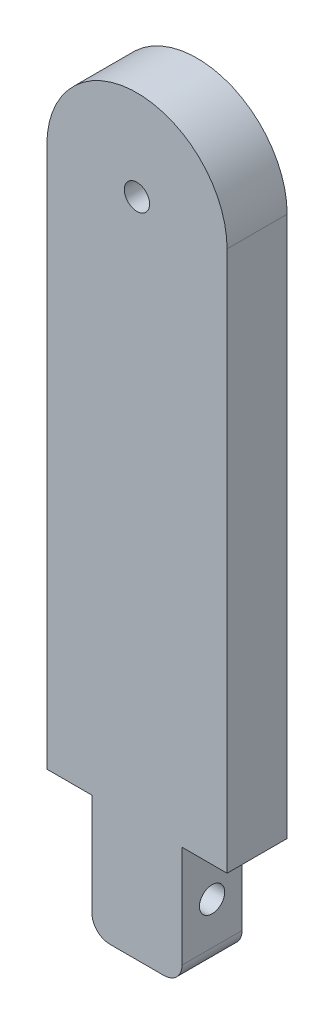
from build123d import *

# Parameters (mm, degrees)
SKETCH_1_W          = 30
SKETCH_1_H          = 125
EXTRUDE_1_DEPTH     = 10
SKETCH_2_W          = 7.5
SKETCH_2_H          = 20
CUT_EXTRUDE_1_DEPTH = 10
FILLET_1_R          = 3
SKETCH_3_R          = 2.1
CUT_EXTRUDE_2_DEPTH = 129.937969582
FILLET_2_RADIUS     = 15
FILLET_2_LENGTH     = 10
SKETCH_4_R          = 2.1
CUT_EXTRUDE_3_DEPTH = 129.937969582


with BuildPart() as part:
    # 草图1 → 凸台-拉伸1 (new body)
    with BuildSketch(Plane.XY):
        with Locations((15, 62.5)):
            Rectangle(SKETCH_1_W, SKETCH_1_H)
    extrude(amount=EXTRUDE_1_DEPTH)

    # 草图2 → 切除-拉伸1 (cut)
    with BuildSketch(Plane.XY.offset(10)):
        with Locations((3.75, 10)):
            Rectangle(SKETCH_2_W, SKETCH_2_H)
        with Locations((26.25, 10)):
            Rectangle(SKETCH_2_W, SKETCH_2_H)
    extrude(amount=-CUT_EXTRUDE_1_DEPTH, mode=Mode.SUBTRACT)

    # 圆角1
    fillet_1_edges = [part.edges().sort_by_distance(p)[0] for p in [
        (7.5, 0, 5),
        (22.5, 0, 5),
    ]]
    fillet(fillet_1_edges, radius=FILLET_1_R)

    # 草图3 → 切除-拉伸2 (cut, through all)
    with BuildSketch(Plane.ZY):
        with Locations((5, 10)):
            Circle(SKETCH_3_R)
    extrude(amount=-CUT_EXTRUDE_2_DEPTH, mode=Mode.SUBTRACT)

    # 圆角2: full round fillet: the end face becomes a half cylinder, R = half its width
    fillet_2_face = Plane((15, 125, 5), x_dir=(0, 0, 1), z_dir=(0, 1, 0))  # on the end face: x along it, z out of the body
    fillet_2_slab = fillet_2_face.offset(-FILLET_2_RADIUS / 2) * Box(FILLET_2_LENGTH, 2 * FILLET_2_RADIUS, FILLET_2_RADIUS, mode=Mode.PRIVATE)  # the body's end, R deep
    fillet_2_round = Plane((15, 110, 5), x_dir=(0, 1, 0), z_dir=(0, 0, 1)) * Cylinder(FILLET_2_RADIUS, FILLET_2_LENGTH, mode=Mode.PRIVATE)  # its axis R under the face
    add(fillet_2_slab - fillet_2_round, mode=Mode.SUBTRACT)

    # 草图4 → 切除-拉伸3 (cut, through all)
    with BuildSketch(Plane(origin=(0, 0, 0), x_dir=(-1, 0, 0), z_dir=(0, 0, -1))):
        with Locations((-15, 110)):
            Circle(SKETCH_4_R)
    extrude(amount=-CUT_EXTRUDE_3_DEPTH, mode=Mode.SUBTRACT)


solid = part.part
